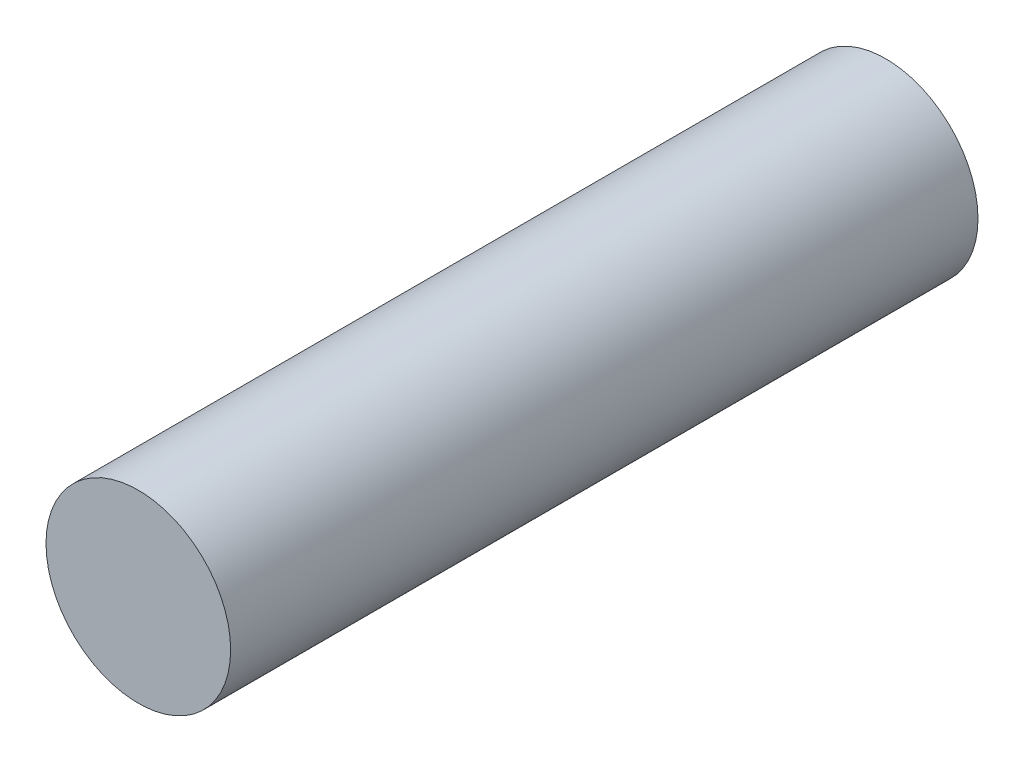
from build123d import *

# Parameters (mm, degrees)
CROQUIS1_R              = 5
SALIENTE_EXTRUIR1_DEPTH = 40.475


with BuildPart() as part:
    # Croquis1 → Saliente-Extruir1 (new body)
    with BuildSketch(Plane.XY):
        Circle(CROQUIS1_R)
    extrude(amount=SALIENTE_EXTRUIR1_DEPTH)


solid = part.part
